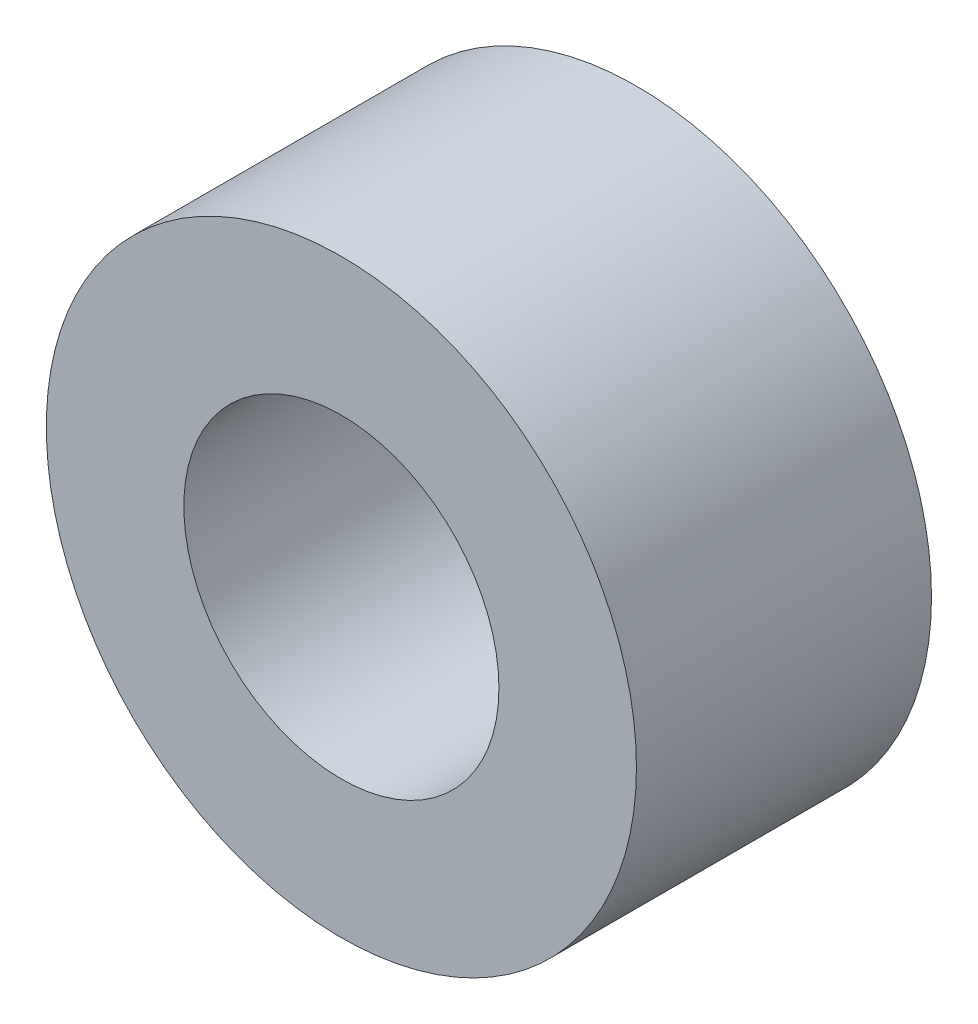
from build123d import *

# Parameters (mm, degrees)
SKETCH1_R           = 6.35
SKETCH1_R_2         = 3.3909
BOSS_EXTRUDE1_DEPTH = 6.35


with BuildPart() as part:
    # Sketch1 → Boss-Extrude1 (new body)
    with BuildSketch(Plane.XY):
        Circle(SKETCH1_R)
        Circle(SKETCH1_R_2, mode=Mode.SUBTRACT)
    extrude(amount=BOSS_EXTRUDE1_DEPTH)


solid = part.part
